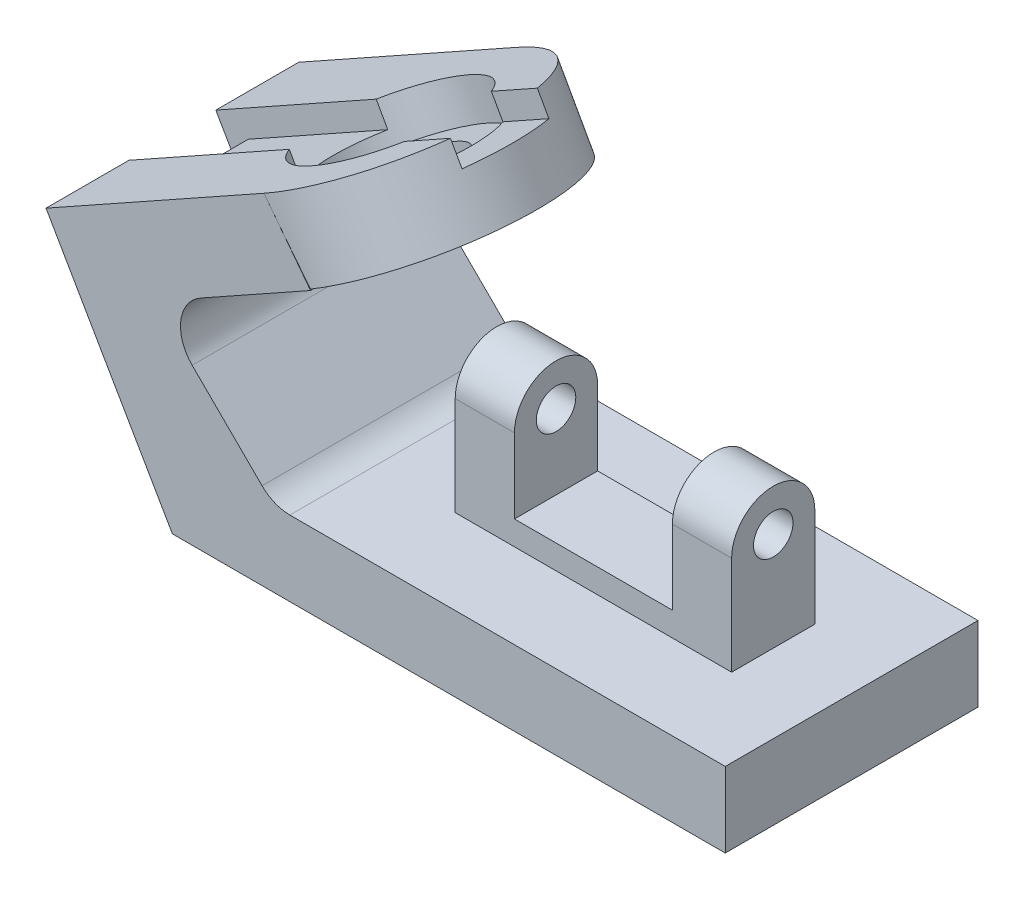
from build123d import *

# Parameters (mm, degrees)
BOSS_EXTRUDE1_DEPTH = 32
FILLET1_R           = 10
FILLET2_R           = 10
BOSS_EXTRUDE2_DEPTH = 19
SKETCH3_R           = 12
CUT_EXTRUDE1_DEPTH  = 19
SKETCH4_R           = 20
CUT_EXTRUDE2_DEPTH  = 9.5
SKETCH5_W           = 146.165275263
SKETCH5_H           = 22
CUT_EXTRUDE3_DEPTH  = 6
SKETCH6_W           = 22
SKETCH6_H           = 63.302471394
CUT_EXTRUDE4_DEPTH  = 6
SKETCH7_W           = 70
SKETCH7_H           = 21.06948543
BOSS_EXTRUDE3_DEPTH = 25
BOSS_EXTRUDE4_DEPTH = 70
SKETCH9_R           = 5
CUT_EXTRUDE5_DEPTH  = 70
SKETCH10_W          = 40
SKETCH10_H          = 90
CUT_EXTRUDE6_DEPTH  = 70


with BuildPart() as part:
    # Sketch1 → Boss-Extrude1 (new, symmetric)
    with BuildSketch(Plane.XY):
        Polygon((0, 0), (140, 0), (140, 19), (25.626336332, 19), (-4.402994998, 48.830779291), (34.987574414, 70.857602718), (23.194010005, 86.289579595), (-32, 55.425625842), align=None)
    extrude(amount=BOSS_EXTRUDE1_DEPTH, both=True)

    # Fillet1
    fillet1_edges = [part.edges().sort_by_distance(p)[0] for p in [
        (-4.402994998, 48.830779291, 0),
    ]]
    fillet(fillet1_edges, radius=FILLET1_R)

    # Fillet2
    fillet2_edges = [part.edges().sort_by_distance(p)[0] for p in [
        (25.626336332, 19, 0),
    ]]
    fillet(fillet2_edges, radius=FILLET2_R)

    # Sketch2 → Boss-Extrude2 (add)
    with BuildSketch(Plane(origin=(-31.233234019, 55.854393924, 0), x_dir=(0.8728071364976854, 0.4880652645689006, 0), z_dir=(-0.48806526456890054, 0.8728071364976853, 0))):
        with BuildLine():
            ThreePointArc((62.358843951, 32), (94.358843951, 0), (62.358843951, -32))
            Line((62.358843951, -32), (62.358843951, 32))
        make_face()
    extrude(amount=-BOSS_EXTRUDE2_DEPTH)

    # Sketch3 → Cut-Extrude1 (cut)
    with BuildSketch(Plane(origin=(-31.233234019, 55.854393924, 0), x_dir=(0.8728071364976854, 0.4880652645689006, 0), z_dir=(-0.48806526456890054, 0.8728071364976853, 0))):
        with Locations(Location((62.358843951, 0, 0), (0, 0, 180))):
            Circle(SKETCH3_R)
    extrude(amount=-CUT_EXTRUDE1_DEPTH, mode=Mode.SUBTRACT)

    # Sketch4 → Cut-Extrude2 (cut)
    with BuildSketch(Plane(origin=(-31.233234019, 55.854393924, 0), x_dir=(0.8728071364976854, 0.4880652645689006, 0), z_dir=(-0.48806526456890054, 0.8728071364976853, 0))):
        with Locations(Location((62.358843951, 0, 0), (0, 0, 180))):
            Circle(SKETCH4_R)
    extrude(amount=-CUT_EXTRUDE2_DEPTH, mode=Mode.SUBTRACT)

    # Sketch5 → Cut-Extrude3 (cut)
    with BuildSketch(Plane(origin=(-31.233234019, 55.854393924, 0), x_dir=(0.8728071364976854, 0.4880652645689006, 0), z_dir=(-0.48806526456890054, 0.8728071364976853, 0))):
        with Locations((62.35884395, 0)):
            Rectangle(SKETCH5_W, SKETCH5_H)
    extrude(amount=-CUT_EXTRUDE3_DEPTH, mode=Mode.SUBTRACT)

    # Sketch6 → Cut-Extrude4 (cut)
    with BuildSketch(Plane(origin=(0, 0, 0), x_dir=(0, 0, 1), z_dir=(-0.8660254037844362, -0.5000000000000046, 0))):
        with Locations((0, 57.999434657)):
            Rectangle(SKETCH6_W, SKETCH6_H)
    extrude(amount=-CUT_EXTRUDE4_DEPTH, mode=Mode.SUBTRACT)

    # Sketch7 → Boss-Extrude3 (add)
    with BuildSketch(Plane(origin=(0, 19, 0), x_dir=(1, 0, 0), z_dir=(0, 1, 0))):
        with Locations((85.152528748, 0)):
            Rectangle(SKETCH7_W, SKETCH7_H)
    extrude(amount=BOSS_EXTRUDE3_DEPTH)

    # Sketch8 → Boss-Extrude4 (add)
    with BuildSketch(Plane(origin=(120.152528748, 0, 0), x_dir=(0, 0, -1), z_dir=(1, 0, 0))):
        with BuildLine():
            ThreePointArc((-10.534742715, 44), (0, 54.534742715), (10.534742715, 44))
            Line((10.534742715, 44), (-10.534742715, 44))
        make_face()
    extrude(amount=-BOSS_EXTRUDE4_DEPTH)

    # Sketch9 → Cut-Extrude5 (cut)
    with BuildSketch(Plane(origin=(120.152528748, 0, 0), x_dir=(0, 0, -1), z_dir=(1, 0, 0))):
        with Locations(Location((0, 44, 0), (0, 0, 90))):
            Circle(SKETCH9_R)
    extrude(amount=-CUT_EXTRUDE5_DEPTH, mode=Mode.SUBTRACT)

    # Sketch10 → Cut-Extrude6 (cut)
    with BuildSketch(Plane.XY.offset(10.534742715)):
        with Locations((85.152528748, 70.106665045)):
            Rectangle(SKETCH10_W, SKETCH10_H)
    extrude(amount=-CUT_EXTRUDE6_DEPTH, mode=Mode.SUBTRACT)


solid = part.part
